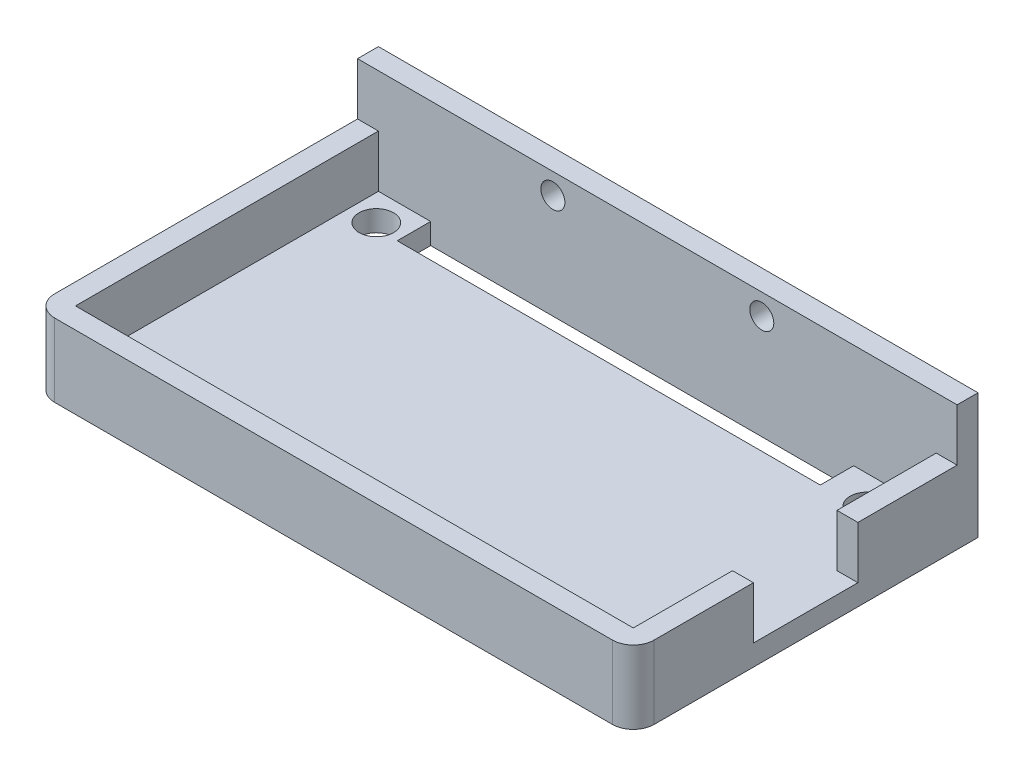
from build123d import *

# Parameters (mm, degrees)
SKETCH1_W           = 57.4
SKETCH1_H           = 33
BOSS_EXTRUDE1_DEPTH = 7
SHELL3_T            = -2
SKETCH2_R           = 1.65
CUT_EXTRUDE1_DEPTH  = 67.398493959
SKETCH3_W           = 40.5
SKETCH3_H           = 3.2
CUT_EXTRUDE2_DEPTH  = 67.398493959
SKETCH4_W           = 2
SKETCH4_H           = 10
CUT_EXTRUDE3_DEPTH  = 5
SKETCH5_W           = 57.4
SKETCH5_H           = 2
BOSS_EXTRUDE2_DEPTH = 5
CUT_EXTRUDE4_REACH  = 69.289
SKETCH6_R           = 1.15
FILLET1_R           = 2


with BuildPart() as part:
    # Sketch1 → Boss-Extrude1 (new body)
    with BuildSketch(Plane(origin=(0, 0, 0), x_dir=(1, 0, 0), z_dir=(0, 1, 0))):
        with Locations((28.7, 16.5)):
            Rectangle(SKETCH1_W, SKETCH1_H)
    extrude(amount=BOSS_EXTRUDE1_DEPTH)

    # Shell3
    shell3_openings = [part.faces().sort_by_distance(p)[0] for p in [
        (28.7, 7, -16.5),
    ]]
    offset(amount=SHELL3_T, openings=shell3_openings, kind=Kind.INTERSECTION)

    # Sketch2 → Cut-Extrude1 (cut, through all)
    with BuildSketch(Plane(origin=(0, 2, 0), x_dir=(1, 0, 0), z_dir=(0, 1, 0))):
        with Locations(Location((4.5, 28.3, 0), (0, 0, 270))):
            Circle(SKETCH2_R)
        with Locations(Location((51.5, 28.3, 0), (0, 0, 270))):
            Circle(SKETCH2_R)
        with Locations(Location((4.5, 4.7, 0), (0, 0, 270))):
            Circle(SKETCH2_R)
        with Locations(Location((51.5, 4.7, 0), (0, 0, 270))):
            Circle(SKETCH2_R)
    extrude(amount=-CUT_EXTRUDE1_DEPTH, mode=Mode.SUBTRACT)

    # Sketch3 → Cut-Extrude2 (cut, through all)
    with BuildSketch(Plane(origin=(0, 2, 0), x_dir=(1, 0, 0), z_dir=(0, 1, 0))):
        with Locations((27.25, 29.4)):
            Rectangle(SKETCH3_W, SKETCH3_H)
        with Locations((27.25, 3.6)):
            Rectangle(SKETCH3_W, SKETCH3_H)
    extrude(amount=-CUT_EXTRUDE2_DEPTH, mode=Mode.SUBTRACT)

    # Sketch4 → Cut-Extrude3 (cut)
    with BuildSketch(Plane(origin=(0, 7, 0), x_dir=(1, 0, 0), z_dir=(0, 1, 0))):
        with Locations((56.4, 16.5)):
            Rectangle(SKETCH4_W, SKETCH4_H)
    extrude(amount=-CUT_EXTRUDE3_DEPTH, mode=Mode.SUBTRACT)

    # Sketch5 → Boss-Extrude2 (add)
    with BuildSketch(Plane(origin=(0, 7, 0), x_dir=(1, 0, 0), z_dir=(0, 1, 0))):
        with Locations((28.7, 32)):
            Rectangle(SKETCH5_W, SKETCH5_H)
    extrude(amount=BOSS_EXTRUDE2_DEPTH)

    # Sketch6 → Cut-Extrude4 (cut, up to next)
    with BuildSketch(Plane(origin=(0, 0, -33), x_dir=(-1, 0, 0), z_dir=(0, 0, -1)), mode=Mode.PRIVATE) as cut_extrude4_sk1:
        with Locations((-38.7, 10)):
            Circle(SKETCH6_R)
    cut_extrude4_tool1 = extrude(cut_extrude4_sk1.sketch, amount=-CUT_EXTRUDE4_REACH, mode=Mode.PRIVATE) & part.part
    # Sketch6 → Cut-Extrude4 (cut, up to next)
    with BuildSketch(Plane(origin=(0, 0, -33), x_dir=(-1, 0, 0), z_dir=(0, 0, -1)), mode=Mode.PRIVATE) as cut_extrude4_sk2:
        with Locations((-18.7, 10)):
            Circle(SKETCH6_R)
    cut_extrude4_tool2 = extrude(cut_extrude4_sk2.sketch, amount=-CUT_EXTRUDE4_REACH, mode=Mode.PRIVATE) & part.part
    add(cut_extrude4_tool1.solids().sort_by_distance((38.7, 10, -33))[0], mode=Mode.SUBTRACT)
    add(cut_extrude4_tool2.solids().sort_by_distance((18.7, 10, -33))[0], mode=Mode.SUBTRACT)

    # Fillet1
    fillet1_edges = [part.edges().sort_by_distance(p)[0] for p in [
        (57.4, 3.5, 0),
        (0, 3.5, 0),
    ]]
    fillet(fillet1_edges, radius=FILLET1_R)


solid = part.part
